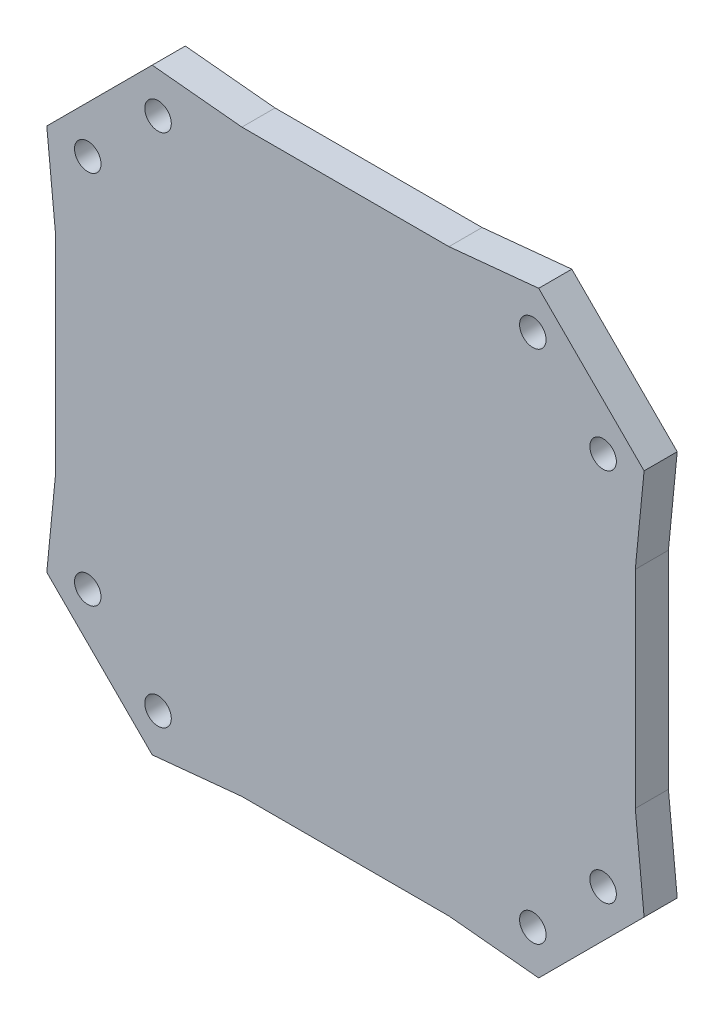
from build123d import *

# Parameters (mm, degrees)
SKETCH1_R           = 1.6
BOSS_EXTRUDE1_DEPTH = 4


with BuildPart() as part:
    # Sketch1 → Boss-Extrude1 (new body)
    with BuildSketch(Plane.XY):
        Polygon((12.5, 35), (-12.5, 35), (-23.334523779, 36.062445841), (-36.062445841, 23.334523779), (-35, 12.5), (-35, -12.5), (-36.062445841, -23.334523779), (-23.334523779, -36.062445841), (-12.5, -35), (12.5, -35), (23.334523779, -36.062445841), (36.062445841, -23.334523779), (35, -12.5), (35, 12.5), (36.062445841, 23.334523779), (23.334523779, 36.062445841), align=None)
        with Locations((22.627416998, 31.112698372)):
            Circle(SKETCH1_R, mode=Mode.SUBTRACT)
        with Locations((31.112698372, 22.627416998)):
            Circle(SKETCH1_R, mode=Mode.SUBTRACT)
        with Locations((22.627416998, -31.112698372)):
            Circle(SKETCH1_R, mode=Mode.SUBTRACT)
        with Locations((31.112698372, -22.627416998)):
            Circle(SKETCH1_R, mode=Mode.SUBTRACT)
        with Locations((-31.112698372, -22.627416998)):
            Circle(SKETCH1_R, mode=Mode.SUBTRACT)
        with Locations((-22.627416998, -31.112698372)):
            Circle(SKETCH1_R, mode=Mode.SUBTRACT)
        with Locations((-22.627416998, 31.112698372)):
            Circle(SKETCH1_R, mode=Mode.SUBTRACT)
        with Locations((-31.112698372, 22.627416998)):
            Circle(SKETCH1_R, mode=Mode.SUBTRACT)
    extrude(amount=BOSS_EXTRUDE1_DEPTH)


solid = part.part
